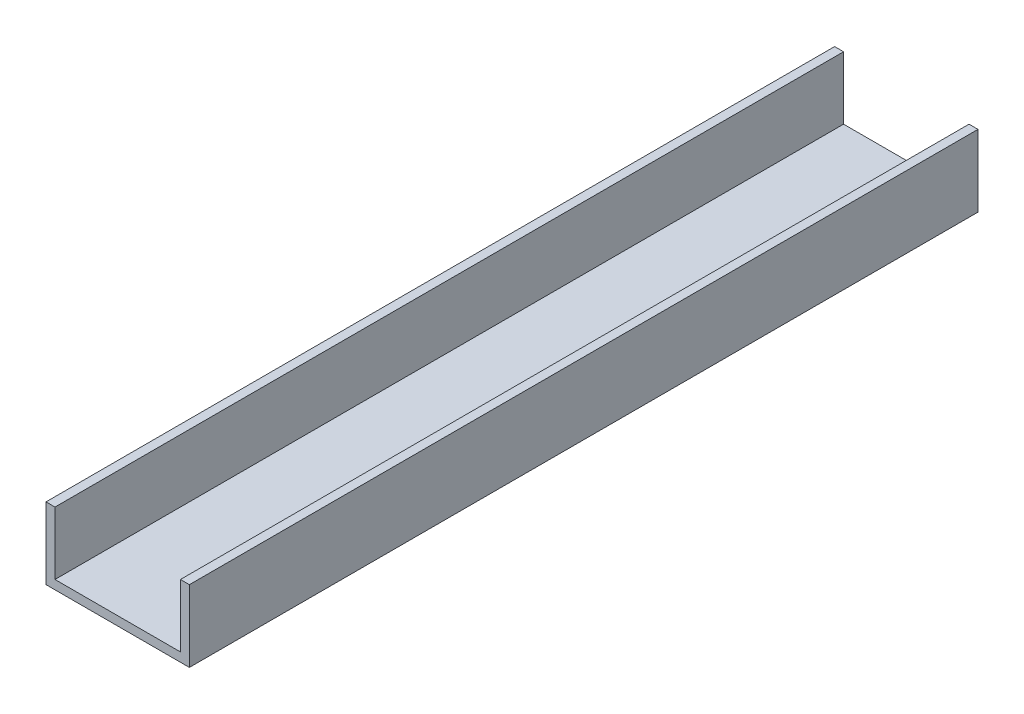
from build123d import *

# Parameters (mm, degrees)
BOSS_EXTRUDE1_DEPTH = 279.4


with BuildPart() as part:
    # Sketch1 → Boss-Extrude1 (new body)
    with BuildSketch(Plane.XY):
        Polygon((3.175, 3.175), (3.175, 25.4), (0, 25.4), (0, 0), (50.8, 0), (50.8, 25.4), (47.625, 25.4), (47.625, 3.175), align=None)
    extrude(amount=BOSS_EXTRUDE1_DEPTH)


solid = part.part
